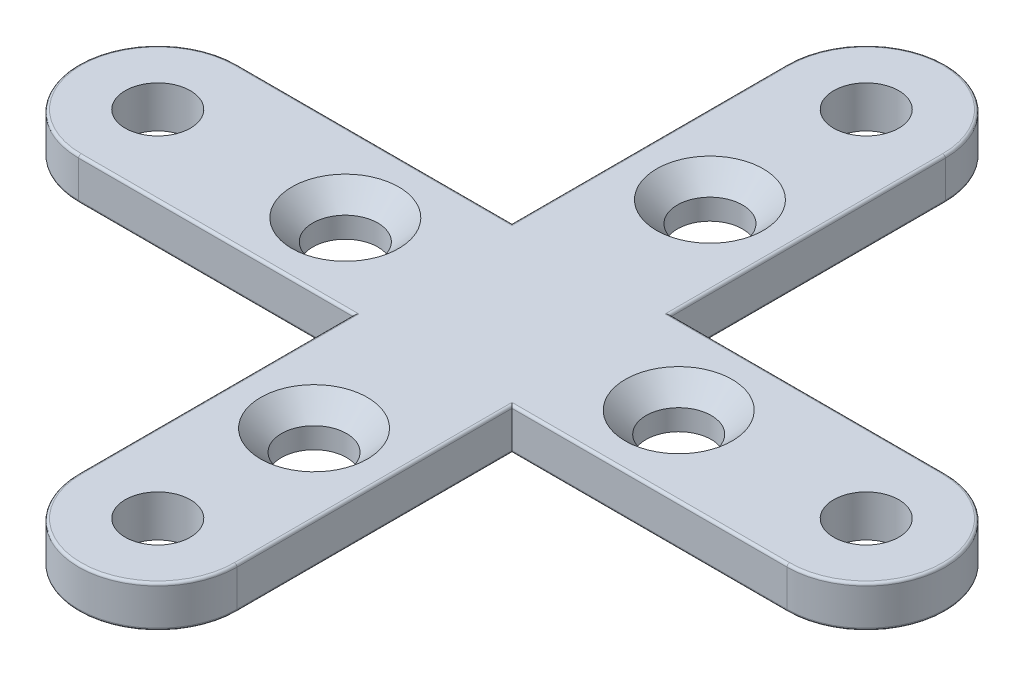
from build123d import *

# Parameters (mm, degrees)
SKETCH1_R           = 1.5625
BOSS_EXTRUDE1_DEPTH = 2
CIRPATTERN1_COUNT   = 2
CIRPATTERN1_ANGLE   = 90
SKETCH2_R           = 1.5625
CUT_EXTRUDE1_DEPTH  = 2
CHAMFER1_SIZE       = 1
FILLET1_R           = 0.125


with BuildPart() as part:
    # Sketch1 → Boss-Extrude1 (new body)
    with BuildSketch(Plane(origin=(0, 0, 0), x_dir=(1, 0, 0), z_dir=(0, 1, 0))):
        with BuildLine():
            Line((-3.8, -17), (-3.8, 17))
            ThreePointArc((-3.8, 17), (0, 20.8), (3.8, 17))
            Line((3.8, 17), (3.8, -17))
            ThreePointArc((3.8, -17), (0, -20.8), (-3.8, -17))
        make_face()
        with Locations(Location((0, 17, 0), (0, 0, 270))):
            Circle(SKETCH1_R, mode=Mode.SUBTRACT)
        with Locations(Location((0, -17, 0), (0, 0, 90))):
            Circle(SKETCH1_R, mode=Mode.SUBTRACT)
    boss_extrude1 = extrude(amount=BOSS_EXTRUDE1_DEPTH)

    # CirPattern1: Boss-Extrude1 ×2 about axis
    cirpattern1_axis = Axis((0, 0, 0), (0, 1, 0))
    for i in range(1, CIRPATTERN1_COUNT):
        add(boss_extrude1.rotate(cirpattern1_axis, i * CIRPATTERN1_ANGLE / (CIRPATTERN1_COUNT - 1)))

    # Sketch2 → Cut-Extrude1 (cut)
    with BuildSketch(Plane(origin=(0, 0, 0), x_dir=(1, 0, 0), z_dir=(0, 1, 0))):
        with Locations(Location((0, 9.5, 0), (0, 0, 270))):
            Circle(SKETCH2_R)
        with Locations(Location((8, 0, 0), (0, 0, 270))):
            Circle(SKETCH2_R)
        with Locations(Location((0, -9.5, 0), (0, 0, 90))):
            Circle(SKETCH2_R)
        with Locations(Location((-8, 0, 0), (0, 0, 90))):
            Circle(SKETCH2_R)
    extrude(amount=CUT_EXTRUDE1_DEPTH, mode=Mode.SUBTRACT)

    # Chamfer1
    chamfer1_edges = [part.edges().sort_by_distance(p)[0] for p in [
        (0, 2, -11.0625),
        (8, 2, -1.5625),
        (0, 2, 11.0625),
        (-8, 2, 1.5625),
    ]]
    chamfer(chamfer1_edges, length=CHAMFER1_SIZE)

    # Fillet1
    fillet1_edges = [part.edges().sort_by_distance(p)[0] for p in [
        (0, 2, -20.8),
        (-3.8, 2, -10.4),
        (-3.8, 0, 10.4),
        (-3.8, 2, 10.4),
        (3.8, 0, -10.4),
        (3.8, 2, -10.4),
        (10.4, 2, 3.8),
        (20.8, 2, 0),
        (10.4, 2, -3.8),
        (-10.4, 2, -3.8),
        (-20.8, 2, 0),
        (-10.4, 2, 3.8),
        (10.4, 0, -3.8),
        (-10.4, 0, -3.8),
        (10.4, 0, 3.8),
        (-10.4, 0, 3.8),
        (20.8, 0, 0),
        (-20.8, 0, 0),
        (0, 2, 20.8),
        (-3.8, 0, -10.4),
        (0, 0, -20.8),
        (3.8, 0, 10.4),
        (0, 0, 20.8),
        (3.8, 2, 10.4),
    ]]
    fillet(fillet1_edges, radius=FILLET1_R)


solid = part.part
